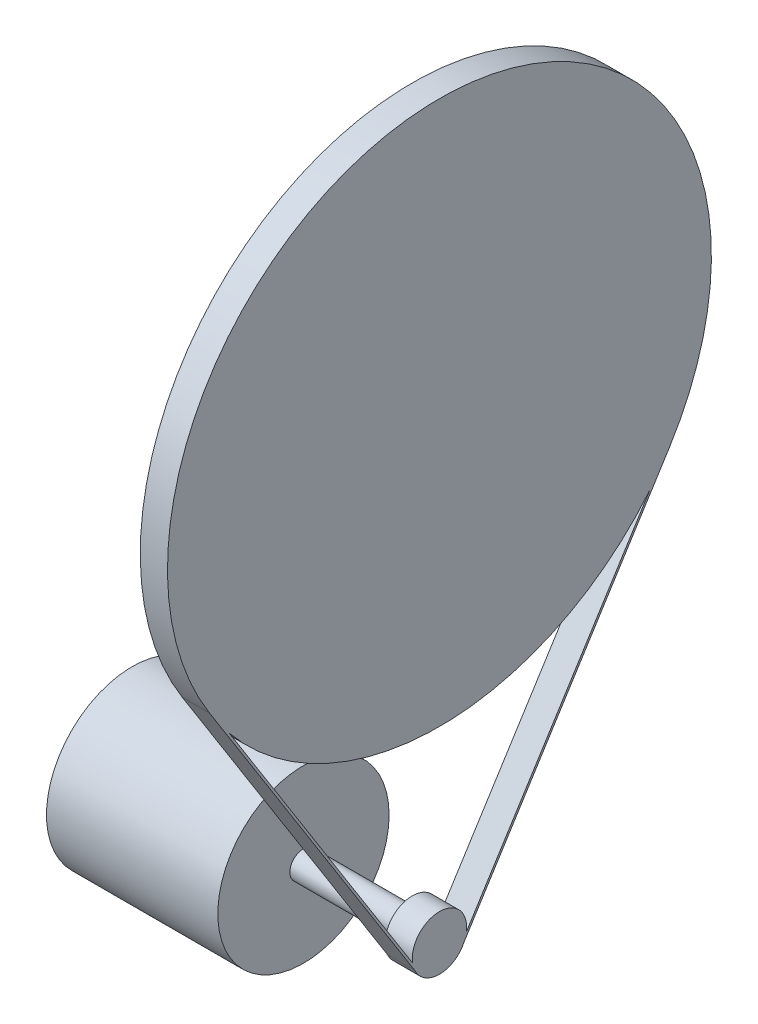
from build123d import *

# Parameters (mm, degrees)
CROQUIS1_R              = 40
SALIENTE_EXTRUIR1_DEPTH = 80
CROQUIS2_R              = 6.35
SALIENTE_EXTRUIR2_DEPTH = 50.8
CROQUIS3_R              = 12.7
SALIENTE_EXTRUIR3_DEPTH = 12.7
SALIENTE_EXTRUIR4_DEPTH = 12.7


with BuildPart() as part:
    # Croquis1 → Saliente-Extruir1 (new body)
    with BuildSketch(Plane(origin=(0, 0, 0), x_dir=(0, 0, -1), z_dir=(1, 0, 0))):
        Circle(CROQUIS1_R)
    extrude(amount=SALIENTE_EXTRUIR1_DEPTH)

    # Croquis2 → Saliente-Extruir2 (add)
    with BuildSketch(Plane(origin=(80, 0, 0), x_dir=(0, 0, -1), z_dir=(1, 0, 0))):
        Circle(CROQUIS2_R)
    extrude(amount=SALIENTE_EXTRUIR2_DEPTH)

    # Croquis3 → Saliente-Extruir3 (add)
    with BuildSketch(Plane(origin=(130.8, 0, 0), x_dir=(0, 0, -1), z_dir=(1, 0, 0))):
        Circle(CROQUIS3_R)
    extrude(amount=SALIENTE_EXTRUIR3_DEPTH)

    # Croquis4 → Saliente-Extruir4 (add)
    with BuildSketch(Plane.ZY.offset(-130.8)):
        with BuildLine():
            Line((11.483957814, -5.422980079), (107.428083159, 146.742000736))
            ThreePointArc((107.428083159, 146.742000736), (0, 341.478305247), (-107.428083159, 146.742000736))
            Line((-107.428083159, 146.742000736), (-11.483957814, -5.422980079))
            ThreePointArc((-11.483957814, -5.422980079), (0, -12.7), (11.483957814, -5.422980079))
        make_face()
        with BuildLine():
            Line((12.567527858, -1.829547361), (98.098634635, 133.820646696))
            ThreePointArc((98.098634635, 133.820646696), (0, 87.478305247), (-98.098634635, 133.820646696))
            Line((-98.098634635, 133.820646696), (-12.567527858, -1.829547361))
            ThreePointArc((-12.567527858, -1.829547361), (0, 12.7), (12.567527858, -1.829547361))
        make_face(mode=Mode.SUBTRACT)
    extrude(amount=-SALIENTE_EXTRUIR4_DEPTH)


solid = part.part
